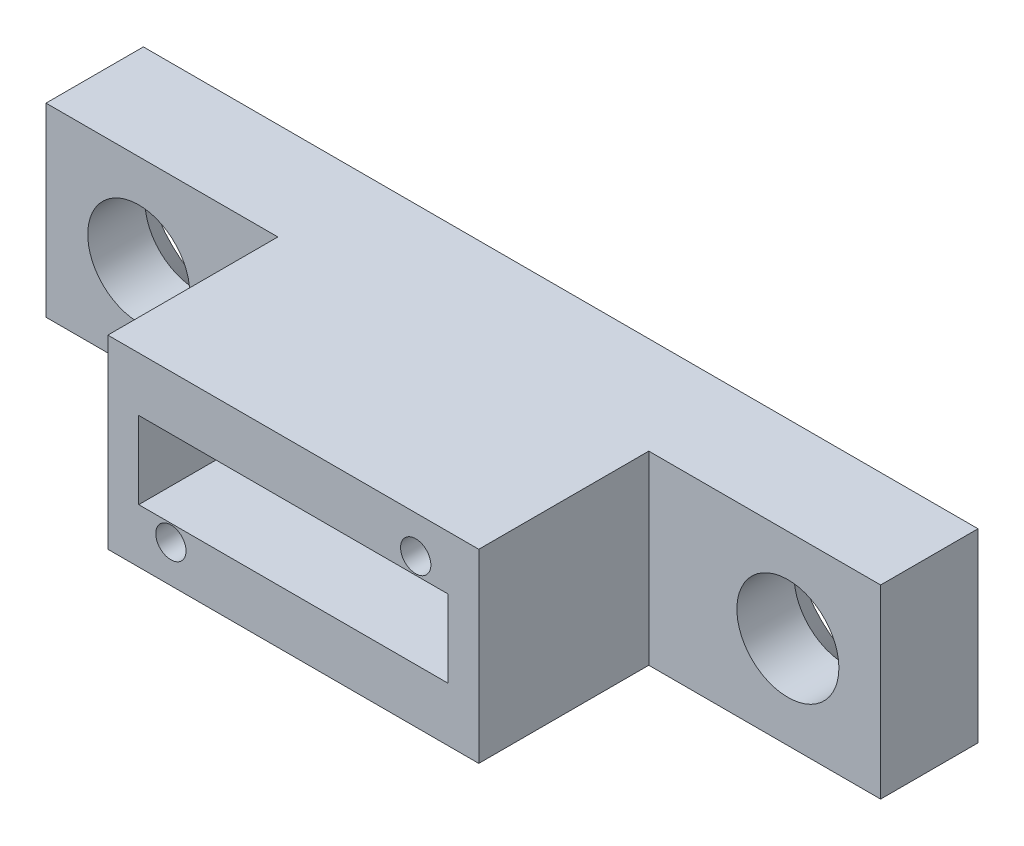
from build123d import *

# Parameters (mm, degrees)
ESQUISSE1_W             = 27
ESQUISSE1_H             = 6
ESQUISSE1_R             = 1.65
BOSS_EXTRU_1_DEPTH      = 3.15
ESQUISSE3_W             = 12
ESQUISSE3_H             = 6
BOSS_EXTRU_2_DEPTH      = 5.5
ESQUISSE4_W             = 10
ESQUISSE4_H             = 2.5
ENL_V_MAT_EXTRU_1_DEPTH = 10
ESQUISSE5_R             = 0.49
ENL_V_MAT_EXTRU_2_DEPTH = 1.5
CHANFREIN1_SIZE         = 1.3


with BuildPart() as part:
    # Esquisse1 → Boss.-Extru.1 (new body)
    with BuildSketch(Plane.XY):
        with Locations((-13.5, 3)):
            Rectangle(ESQUISSE1_W, ESQUISSE1_H)
        with Locations((-24, 3)):
            Circle(ESQUISSE1_R, mode=Mode.SUBTRACT)
        with Locations((-3, 3)):
            Circle(ESQUISSE1_R, mode=Mode.SUBTRACT)
    extrude(amount=BOSS_EXTRU_1_DEPTH)

    # Esquisse3 → Boss.-Extru.2 (add)
    with BuildSketch(Plane.XY.offset(3.15)):
        with Locations((-13.5, 3)):
            Rectangle(ESQUISSE3_W, ESQUISSE3_H)
    extrude(amount=BOSS_EXTRU_2_DEPTH)

    # Esquisse4 → Enlèv. mat.-Extru.1 (cut)
    with BuildSketch(Plane.XY.offset(8.65)):
        with Locations((-13.5, 3)):
            Rectangle(ESQUISSE4_W, ESQUISSE4_H)
    extrude(amount=-ENL_V_MAT_EXTRU_1_DEPTH, mode=Mode.SUBTRACT)

    # Esquisse5 → Enlèv. mat.-Extru.2 (cut)
    with BuildSketch(Plane.XY.offset(8.65)):
        with Locations((-9.54, 4.785)):
            Circle(ESQUISSE5_R)
        with Locations((-17.46, 1.215)):
            Circle(ESQUISSE5_R)
    extrude(amount=-ENL_V_MAT_EXTRU_2_DEPTH, mode=Mode.SUBTRACT)

    # Chanfrein1
    chanfrein1_edges = [part.edges().sort_by_distance(p)[0] for p in [
        (-4.65, 3, 0),
        (-25.65, 3, 0),
    ]]
    chamfer(chanfrein1_edges, length=CHANFREIN1_SIZE)


solid = part.part
